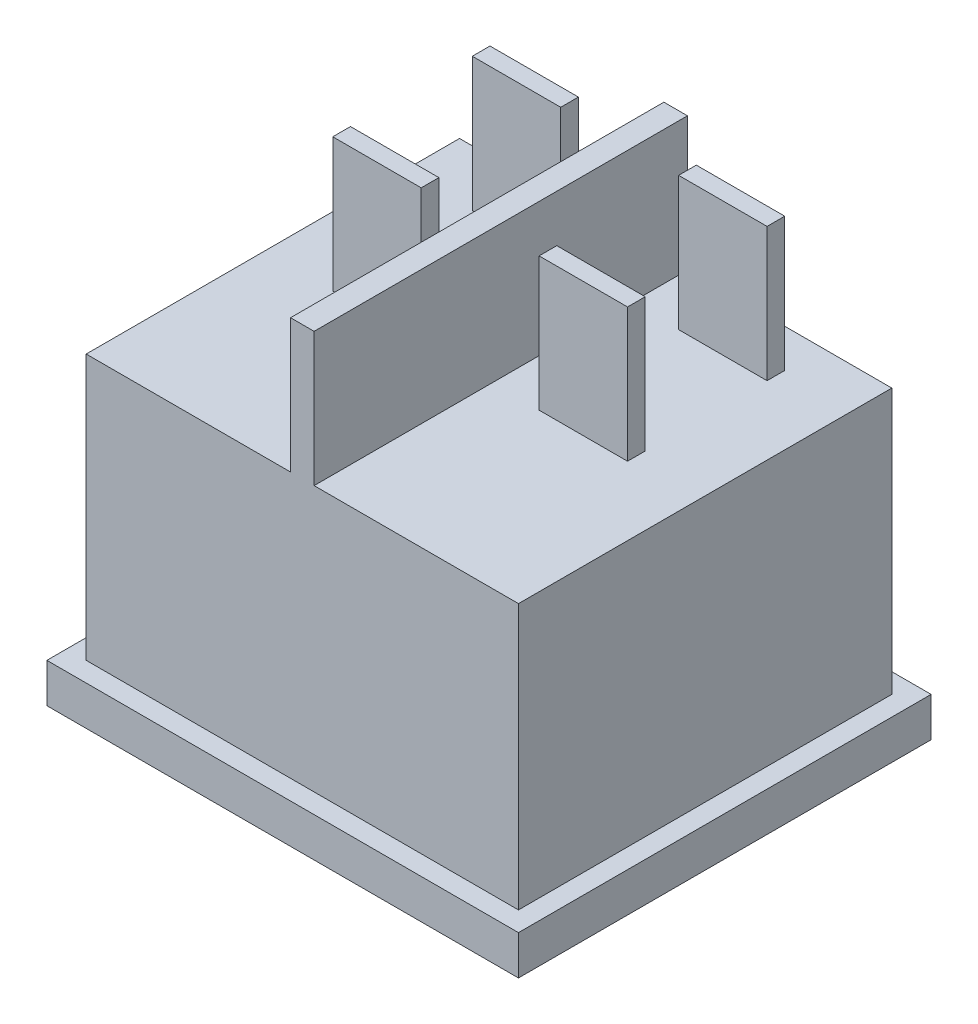
from build123d import *

# Parameters (mm, degrees)
SKETCH1_W           = 24
SKETCH1_H           = 21
BOSS_EXTRUDE1_DEPTH = 2
SKETCH2_W           = 22
SKETCH2_H           = 19
BOSS_EXTRUDE2_DEPTH = 13.5
SKETCH3_W           = 1.2
SKETCH3_H           = 19
BOSS_EXTRUDE3_DEPTH = 6.8
SKETCH4_W           = 4.5
SKETCH4_H           = 0.9
BOSS_EXTRUDE4_DEPTH = 6.8


with BuildPart() as part:
    # Sketch1 → Boss-Extrude1 (new body)
    with BuildSketch(Plane(origin=(0, 0, 0), x_dir=(1, 0, 0), z_dir=(0, 1, 0))):
        Rectangle(SKETCH1_W, SKETCH1_H)
    extrude(amount=BOSS_EXTRUDE1_DEPTH)

    # Sketch2 → Boss-Extrude2 (add)
    with BuildSketch(Plane(origin=(0, 2, 0), x_dir=(1, 0, 0), z_dir=(0, 1, 0))):
        Rectangle(SKETCH2_W, SKETCH2_H)
    extrude(amount=BOSS_EXTRUDE2_DEPTH)

    # Sketch3 → Boss-Extrude3 (add)
    with BuildSketch(Plane(origin=(0, 15.5, 0), x_dir=(1, 0, 0), z_dir=(0, 1, 0))):
        Rectangle(SKETCH3_W, SKETCH3_H)
    extrude(amount=BOSS_EXTRUDE3_DEPTH)

    # Sketch4 → Boss-Extrude4 (add)
    with BuildSketch(Plane(origin=(0, 15.5, 0), x_dir=(1, 0, 0), z_dir=(0, 1, 0))):
        with Locations((-5.25, 7.1)):
            Rectangle(SKETCH4_W, SKETCH4_H)
        with Locations((-5.25, 0)):
            Rectangle(SKETCH4_W, SKETCH4_H)
        with Locations((5.25, 7.1)):
            Rectangle(SKETCH4_W, SKETCH4_H)
        with Locations((5.25, 0)):
            Rectangle(SKETCH4_W, SKETCH4_H)
    extrude(amount=BOSS_EXTRUDE4_DEPTH)


solid = part.part
